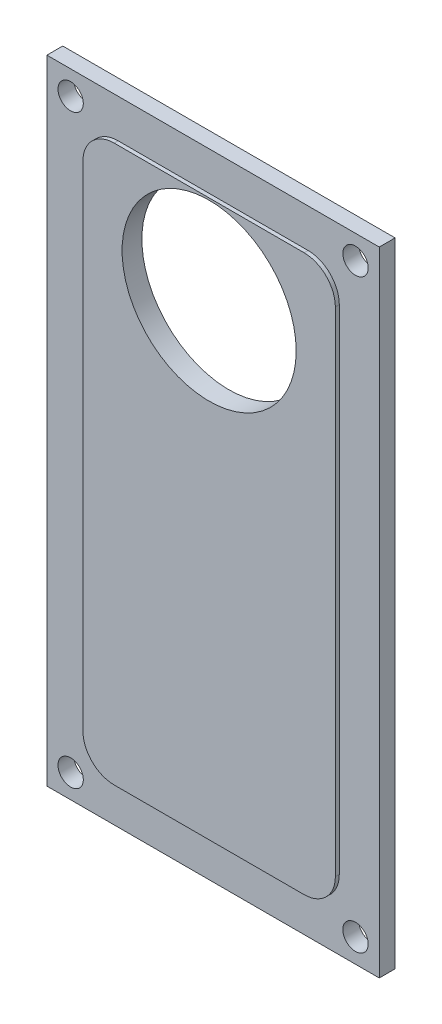
from build123d import *

# Parameters (mm, degrees)
SKETCH2_W           = 42
SKETCH2_H           = 80
BOSS_EXTRUDE1_DEPTH = 2
SKETCH5_W           = 31.9
SKETCH5_H           = 70.25
BOSS_EXTRUDE2_DEPTH = 0.5
FILLET1_R           = 3.95
SKETCH7_R           = 11
CUT_EXTRUDE1_DEPTH  = 46.24654683
SKETCH8_R           = 1.6
CUT_EXTRUDE2_DEPTH  = 46.24654683


with BuildPart() as part:
    # Sketch2 → Boss-Extrude1 (new body)
    with BuildSketch(Plane.XY):
        Rectangle(SKETCH2_W, SKETCH2_H)
    extrude(amount=BOSS_EXTRUDE1_DEPTH)

    # Sketch5 → Boss-Extrude2 (add)
    with BuildSketch(Plane.XY.offset(2)):
        Rectangle(SKETCH5_W, SKETCH5_H)
    extrude(amount=BOSS_EXTRUDE2_DEPTH)

    # Fillet1
    fillet1_edges = [part.edges().sort_by_distance(p)[0] for p in [
        (15.95, -35.125, 2.25),
        (15.95, 35.125, 2.25),
        (-15.95, 35.125, 2.25),
        (-15.95, -35.125, 2.25),
    ]]
    fillet(fillet1_edges, radius=FILLET1_R)

    # Sketch7 → Cut-Extrude1 (cut, through all)
    with BuildSketch(Plane.XY.offset(2.5)):
        with Locations((0, 23.875)):
            Circle(SKETCH7_R)
    extrude(amount=-CUT_EXTRUDE1_DEPTH, mode=Mode.SUBTRACT)

    # Sketch8 → Cut-Extrude2 (cut, through all)
    with BuildSketch(Plane(origin=(0, 0, 0), x_dir=(-1, 0, 0), z_dir=(0, 0, -1))):
        with Locations((18, 37)):
            Circle(SKETCH8_R)
        with Locations((-18, 37)):
            Circle(SKETCH8_R)
        with Locations((-18, -37)):
            Circle(SKETCH8_R)
        with Locations((18, -37)):
            Circle(SKETCH8_R)
    extrude(amount=-CUT_EXTRUDE2_DEPTH, mode=Mode.SUBTRACT)


solid = part.part
